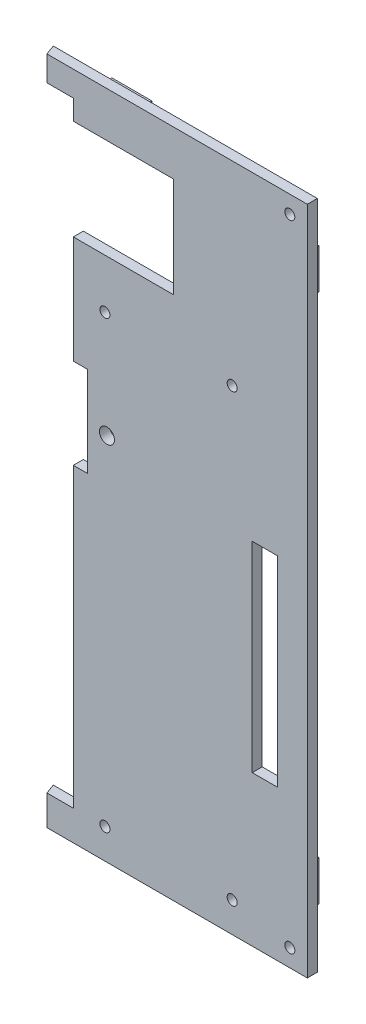
from build123d import *

# Parameters (mm, degrees)
SKETCH1_R           = 1
SKETCH1_R_2         = 1.5
BOSS_EXTRUDE1_DEPTH = 2
CUT_EXTRUDE1_DEPTH  = 146.720996494
SKETCH3_W           = 5
SKETCH3_H           = 40
SKETCH3_W_2         = 20
SKETCH3_H_2         = 20
SKETCH3_W_3         = 28
SKETCH3_H_3         = 18
CUT_EXTRUDE2_DEPTH  = 2
SKETCH4_R           = 1
CUT_EXTRUDE3_DEPTH  = 2
SKETCH5_W           = 8
SKETCH5_H           = 1.5
SKETCH5_W_2         = 1.5
SKETCH5_H_2         = 8
BOSS_EXTRUDE2_DEPTH = 4


with BuildPart() as part:
    # Sketch1 → Boss-Extrude1 (new body)
    with BuildSketch(Plane.XY):
        Polygon((5.071460992, -3.5), (57.78242964, -3.5), (57.78242964, 130.260231922), (5.071460992, 130.260231922), (5.071460992, 125.260231922), (11.071460992, 125.260231922), (11.071460992, 2.5), (5.071460992, 2.5), align=None)
        with Locations((54.28242964, 0)):
            Circle(SKETCH1_R, mode=Mode.SUBTRACT)
        with Locations((54.28242964, 126.760231922)):
            Circle(SKETCH1_R, mode=Mode.SUBTRACT)
        with Locations((17.78242964, 70.260231922)):
            Circle(SKETCH1_R_2, mode=Mode.SUBTRACT)
    extrude(amount=BOSS_EXTRUDE1_DEPTH)

    # Sketch2 → Cut-Extrude1 (cut, through all)
    with BuildSketch(Plane.XZ.offset(3.5)):
        Polygon((6.036400554, 2.65114966), (1.157662204, -10.753073792), (3.527877144, 2.341321616), align=None)
    extrude(amount=-CUT_EXTRUDE1_DEPTH, mode=Mode.SUBTRACT)

    # Sketch3 → Cut-Extrude2 (cut)
    with BuildSketch(Plane.XY.offset(2)):
        with Locations((49.28242964, 46.5)):
            Rectangle(SKETCH3_W, SKETCH3_H)
        with Locations((21.071460992, 111.260231922)):
            Rectangle(SKETCH3_W_2, SKETCH3_H_2)
        with Locations((-0.078047732, 70.780115961)):
            Rectangle(SKETCH3_W_3, SKETCH3_H_3)
    extrude(amount=-CUT_EXTRUDE2_DEPTH, mode=Mode.SUBTRACT)

    # Sketch4 → Cut-Extrude3 (cut)
    with BuildSketch(Plane.XY.offset(2)):
        with Locations((17.38242964, 2.5)):
            Circle(SKETCH4_R)
        with Locations((42.78242964, 2.5)):
            Circle(SKETCH4_R)
        with Locations((42.78242964, 91.4)):
            Circle(SKETCH4_R)
        with Locations((17.38242964, 91.4)):
            Circle(SKETCH4_R)
    extrude(amount=-CUT_EXTRUDE3_DEPTH, mode=Mode.SUBTRACT)

    # Sketch5 → Boss-Extrude2 (add)
    with BuildSketch(Plane.XY.offset(2)):
        with Locations((18.78242964, 127.860231922)):
            Rectangle(SKETCH5_W, SKETCH5_H)
        with Locations((18.78242964, -1.1)):
            Rectangle(SKETCH5_W, SKETCH5_H)
        with Locations((55.38242964, 116.260231922)):
            Rectangle(SKETCH5_W_2, SKETCH5_H_2)
        with Locations((55.38242964, 10.5)):
            Rectangle(SKETCH5_W_2, SKETCH5_H_2)
    extrude(amount=-BOSS_EXTRUDE2_DEPTH)


solid = part.part
